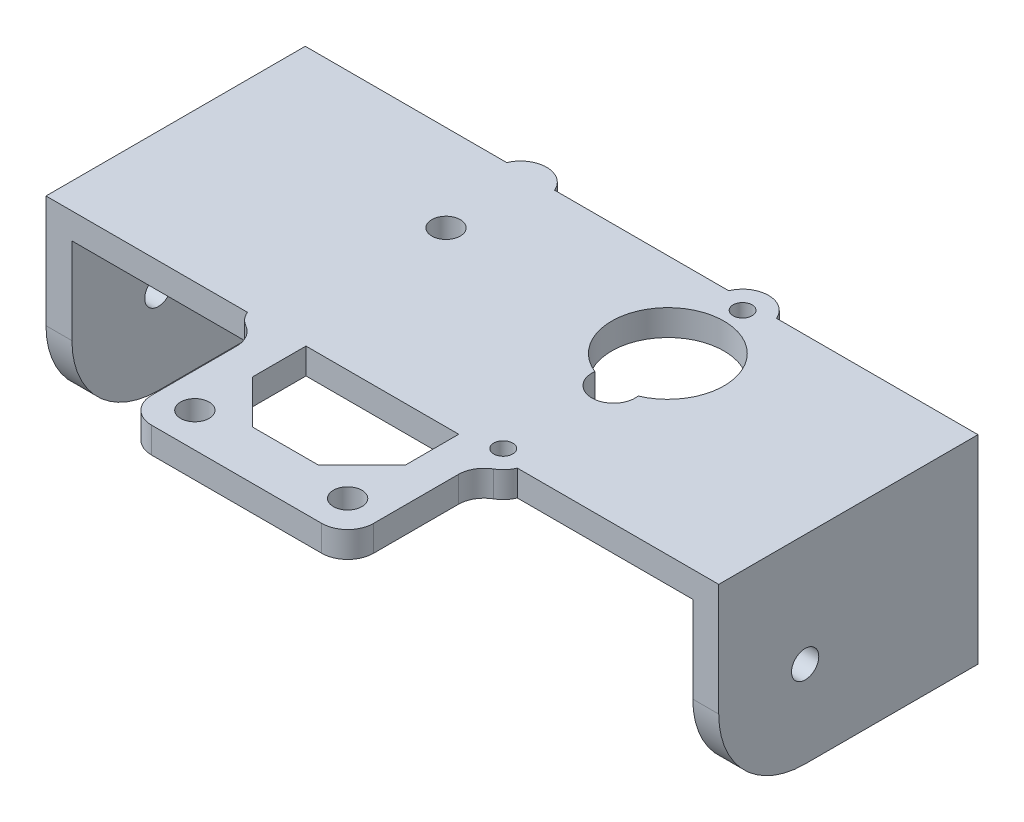
from build123d import *

# Parameters (mm, degrees)
SKETCH1_W           = 3
SKETCH1_H           = 20
SKETCH1_H_2         = 3
SKETCH1_W_2         = 71.840634077
BOSS_EXTRUDE1_DEPTH = 30
FILLET1_R           = 10
SKETCH2_R           = 1.575
CUT_EXTRUDE1_DEPTH  = 50
SKETCH3_R           = 6.5
SKETCH3_R_2         = 2.5
SKETCH3_R_3         = 1.1
SKETCH3_R_4         = 1.65
CUT_EXTRUDE2_DEPTH  = 3
SKETCH4_R           = 1.65
BOSS_EXTRUDE2_DEPTH = 3
FILLET3_R           = 3


with BuildPart() as part:
    # Sketch1 → Boss-Extrude1 (new body)
    with BuildSketch(Plane.XY):
        with Locations((-37.346255817, -2.476707935)):
            Rectangle(SKETCH1_W, SKETCH1_H)
        with Locations((-37.346255817, 9.023292065)):
            Rectangle(SKETCH1_W, SKETCH1_H_2)
        with Locations((0.074061222, 9.023292065)):
            Rectangle(SKETCH1_W_2, SKETCH1_H_2)
        with Locations((37.49437826, 9.023292065)):
            Rectangle(SKETCH1_W, SKETCH1_H_2)
        with Locations((37.49437826, -2.476707935)):
            Rectangle(SKETCH1_W, SKETCH1_H)
    extrude(amount=BOSS_EXTRUDE1_DEPTH)

    # Fillet1
    fillet1_edges = [part.edges().sort_by_distance(p)[0] for p in [
        (37.49437826, -12.476707935, 30),
        (-37.346255817, -12.476707935, 30),
    ]]
    fillet(fillet1_edges, radius=FILLET1_R)

    # Sketch2 → Cut-Extrude1 (cut, symmetric)
    with BuildSketch(Plane(origin=(0, 0, 0), x_dir=(0, 0, -1), z_dir=(1, 0, 0))):
        with Locations((-20, -2.476707935)):
            Circle(SKETCH2_R)
    extrude(amount=CUT_EXTRUDE1_DEPTH, both=True, mode=Mode.SUBTRACT)

    # Sketch3 → Cut-Extrude2 (cut)
    with BuildSketch(Plane(origin=(0, 10.523292065, 0), x_dir=(1, 0, 0), z_dir=(0, 1, 0))):
        with Locations((12.913568062, -9.80768247)):
            Circle(SKETCH3_R)
        with Locations((12.988568062, -16.167156082)):
            Circle(SKETCH3_R_2)
        with Locations(Location((12.913568062, -1.15768247, 0), (0, 0, 270))):
            Circle(SKETCH3_R_3)
        with Locations(Location((12.913568062, -28.85768247, 0), (0, 0, 270))):
            Circle(SKETCH3_R_3)
        with Locations(Location((-12.507980061, -10.050384435, 0), (0, 0, 270))):
            Circle(SKETCH3_R_4)
    extrude(amount=-CUT_EXTRUDE2_DEPTH, mode=Mode.SUBTRACT)

    # Sketch4 → Boss-Extrude2 (add)
    # profile 1 of 5: a face of its own
    with BuildSketch(Plane(origin=(0, 10.523292065, 0), x_dir=(1, 0, 0), z_dir=(0, 1, 0))):
        with BuildLine():
            Line((15.687574309, -30), (10.139561814, -30))
            ThreePointArc((10.139561814, -30), (11.244279679, -31.350367026), (12.913568062, -31.85768247))
            ThreePointArc((12.913568062, -31.85768247), (14.582856444, -31.350367026), (15.687574309, -30))
        make_face()
    # profile 2 of 5: a face of its own
    with BuildSketch(Plane(origin=(0, 10.523292065, 0), x_dir=(1, 0, 0), z_dir=(0, 1, 0))):
        with BuildLine():
            Line((10.145938878, 0), (15.681197245, 0))
            ThreePointArc((15.681197245, 0), (12.913568062, 1.84231753), (10.145938878, 0))
        make_face()
    # profile 3 of 5: a face of its own
    with BuildSketch(Plane(origin=(0, 10.523292065, 0), x_dir=(1, 0, 0), z_dir=(0, 1, 0))):
        with BuildLine():
            Line((-3.765445619, -41.20768247), (-8.765445619, -36.20768247))
            Line((-8.765445619, -36.20768247), (-8.765445619, -30))
            Line((-8.765445619, -30), (-9.991439371, -30))
            ThreePointArc((-9.991439371, -30), (-11.096157236, -31.350367026), (-12.765445619, -31.85768247))
            Line((-12.765445619, -31.85768247), (-12.765445619, -46.85768247))
            Line((-12.765445619, -46.85768247), (-6.765445619, -46.85768247))
            Line((-6.765445619, -46.85768247), (6.913568062, -46.85768247))
            Line((6.913568062, -46.85768247), (12.913568062, -46.85768247))
            Line((12.913568062, -46.85768247), (12.913568062, -31.85768247))
            ThreePointArc((12.913568062, -31.85768247), (11.244279679, -31.350367026), (10.139561814, -30))
            Line((10.139561814, -30), (8.913568062, -30))
            Line((8.913568062, -30), (8.913568062, -36.20768247))
            Line((8.913568062, -36.20768247), (3.913568062, -41.20768247))
            Line((3.913568062, -41.20768247), (-3.765445619, -41.20768247))
        make_face()
        with Locations(Location((-8.765445619, -42.85768247, 0), (0, 0, 270))):
            Circle(SKETCH4_R, mode=Mode.SUBTRACT)
        with Locations(Location((8.913568062, -42.85768247, 0), (0, 0, 270))):
            Circle(SKETCH4_R, mode=Mode.SUBTRACT)
    # profile 4 of 5: a face of its own
    with BuildSketch(Plane(origin=(0, 10.523292065, 0), x_dir=(1, 0, 0), z_dir=(0, 1, 0))):
        with BuildLine():
            ThreePointArc((-12.765445619, -31.85768247), (-11.096157236, -31.350367026), (-9.991439371, -30))
            Line((-9.991439371, -30), (-15.539451866, -30))
            ThreePointArc((-15.539451866, -30), (-14.434734002, -31.350367026), (-12.765445619, -31.85768247))
        make_face()
    # profile 5 of 5: a face of its own
    with BuildSketch(Plane(origin=(0, 10.523292065, 0), x_dir=(1, 0, 0), z_dir=(0, 1, 0))):
        with BuildLine():
            Line((-15.533074803, 0), (-9.997816435, 0))
            ThreePointArc((-9.997816435, 0), (-12.765445619, 1.84231753), (-15.533074803, 0))
        make_face()
    extrude(amount=-BOSS_EXTRUDE2_DEPTH)

    # Fillet3
    fillet3_edges = [part.edges().sort_by_distance(p)[0] for p in [
        (12.913568062, 9.023292065, 31.85768247),
        (12.913568062, 9.023292065, 46.85768247),
        (-12.765445619, 9.023292065, 46.85768247),
        (-12.765445619, 9.023292065, 31.85768247),
    ]]
    fillet(fillet3_edges, radius=FILLET3_R)


solid = part.part
